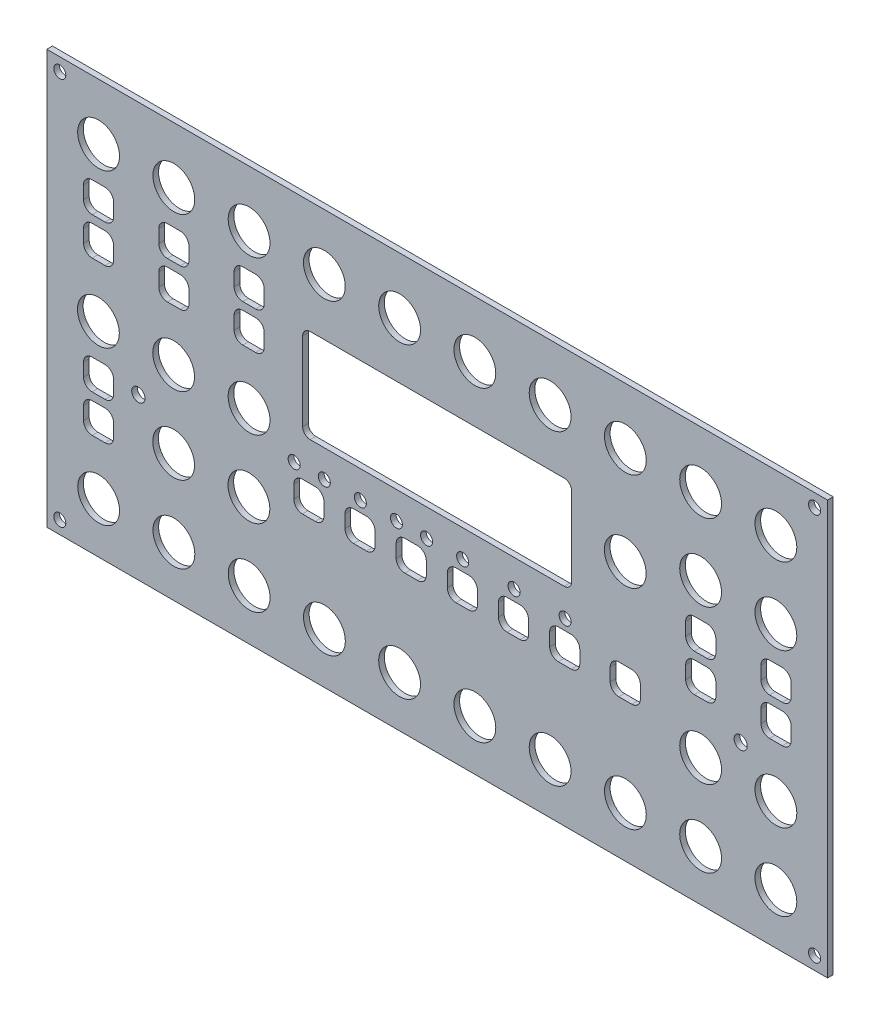
from build123d import *

# Parameters (mm, degrees)
MODEL_W         = 207.5
MODEL_H         = 110
MODEL_RX        = 5.5563
MODEL_RY        = 5.5563
MODEL_RX_2      = 1.7656
MODEL_RY_2      = 1.7656
MODEL_RX_3      = 1.6
MODEL_RY_3      = 1.6
MODEL_RX_4      = 1.75
MODEL_RY_4      = 1.75
EXTRUDE_1_DEPTH = 1.5


with BuildPart() as part:
    # Model → Бобышка-Вытянуть1 (new body)
    with BuildSketch(Plane.XY):
        with Locations((-6.3877, 3.0966)):
            Rectangle(MODEL_W, MODEL_H)
        with Locations(Location((-96.3727, 43.142), (0, 0, 90))):
            Ellipse(MODEL_RX, MODEL_RY, mode=Mode.SUBTRACT)
        with Locations(Location((-76.3738, 43.142), (0, 0, 90))):
            Ellipse(MODEL_RX, MODEL_RY, mode=Mode.SUBTRACT)
        with Locations(Location((-96.4221, 2.3418), (0, 0, 90))):
            Ellipse(MODEL_RX, MODEL_RY, mode=Mode.SUBTRACT)
        with Locations(Location((-76.4232, 2.3418), (0, 0, 90))):
            Ellipse(MODEL_RX, MODEL_RY, mode=Mode.SUBTRACT)
        with Locations(Location((-96.3568, -38.4583), (0, 0, 90))):
            Ellipse(MODEL_RX, MODEL_RY, mode=Mode.SUBTRACT)
        with Locations(Location((-76.3579, -38.4583), (0, 0, 90))):
            Ellipse(MODEL_RX, MODEL_RY, mode=Mode.SUBTRACT)
        with Locations(Location((-56.3572, -38.4583), (0, 0, 90))):
            Ellipse(MODEL_RX, MODEL_RY, mode=Mode.SUBTRACT)
        with Locations(Location((-36.3583, -38.4583), (0, 0, 90))):
            Ellipse(MODEL_RX, MODEL_RY, mode=Mode.SUBTRACT)
        with Locations(Location((-16.3735, -38.4583), (0, 0, 90))):
            Ellipse(MODEL_RX, MODEL_RY, mode=Mode.SUBTRACT)
        with Locations((3.6254, -38.4583)):
            Ellipse(MODEL_RX, MODEL_RY, mode=Mode.SUBTRACT)
        with Locations(Location((23.6261, -38.4583), (0, 0, 90))):
            Ellipse(MODEL_RX, MODEL_RY, mode=Mode.SUBTRACT)
        with Locations(Location((43.625, -38.4583), (0, 0, 90))):
            Ellipse(MODEL_RX, MODEL_RY, mode=Mode.SUBTRACT)
        with Locations(Location((63.6257, -38.4583), (0, 0, 90))):
            Ellipse(MODEL_RX, MODEL_RY, mode=Mode.SUBTRACT)
        with Locations(Location((63.6257, -18.0591), (0, 0, 90))):
            Ellipse(MODEL_RX, MODEL_RY, mode=Mode.SUBTRACT)
        with Locations(Location((83.6246, -18.0591), (0, 0, 90))):
            Ellipse(MODEL_RX, MODEL_RY, mode=Mode.SUBTRACT)
        with Locations(Location((63.6257, 22.7411), (0, 0, 90))):
            Ellipse(MODEL_RX, MODEL_RY, mode=Mode.SUBTRACT)
        with Locations(Location((83.6246, 22.7411), (0, 0, 90))):
            Ellipse(MODEL_RX, MODEL_RY, mode=Mode.SUBTRACT)
        with Locations(Location((63.6257, 43.142), (0, 0, 90))):
            Ellipse(MODEL_RX, MODEL_RY, mode=Mode.SUBTRACT)
        with Locations(Location((83.6246, 43.142), (0, 0, 90))):
            Ellipse(MODEL_RX, MODEL_RY, mode=Mode.SUBTRACT)
        with Locations(Location((23.6261, 43.142), (0, 0, 90))):
            Ellipse(MODEL_RX, MODEL_RY, mode=Mode.SUBTRACT)
        with Locations(Location((43.625, 43.142), (0, 0, 90))):
            Ellipse(MODEL_RX, MODEL_RY, mode=Mode.SUBTRACT)
        with Locations(Location((-16.3735, 43.142), (0, 0, 90))):
            Ellipse(MODEL_RX, MODEL_RY, mode=Mode.SUBTRACT)
        with Locations((3.6254, 43.142)):
            Ellipse(MODEL_RX, MODEL_RY, mode=Mode.SUBTRACT)
        with Locations(Location((-76.4215, -18.0591), (0, 0, 90))):
            Ellipse(MODEL_RX, MODEL_RY, mode=Mode.SUBTRACT)
        with Locations(Location((-56.4226, -18.0591), (0, 0, 90))):
            Ellipse(MODEL_RX, MODEL_RY, mode=Mode.SUBTRACT)
        with Locations(Location((-56.3731, 43.142), (0, 0, 90))):
            Ellipse(MODEL_RX, MODEL_RY, mode=Mode.SUBTRACT)
        with Locations(Location((-36.3742, 43.142), (0, 0, 90))):
            Ellipse(MODEL_RX, MODEL_RY, mode=Mode.SUBTRACT)
        with Locations(Location((-56.3749, 2.3418), (0, 0, 90))):
            Ellipse(MODEL_RX, MODEL_RY, mode=Mode.SUBTRACT)
        with Locations(Location((43.5968, 17.0508), (0, 0, 90))):
            Ellipse(MODEL_RX, MODEL_RY, mode=Mode.SUBTRACT)
        with Locations(Location((-85.8018, -9.238), (0, 0, 180))):
            Ellipse(MODEL_RX_2, MODEL_RY_2, mode=Mode.SUBTRACT)
        with Locations(Location((-106.6826, 54.6408), (0, 0, 270))):
            Ellipse(MODEL_RX_3, MODEL_RY_3, mode=Mode.SUBTRACT)
        with Locations(Location((-106.6826, -48.4638), (0, 0, 270))):
            Ellipse(MODEL_RX_3, MODEL_RY_3, mode=Mode.SUBTRACT)
        with Locations(Location((93.8945, 54.6408), (0, 0, 180))):
            Ellipse(MODEL_RX_3, MODEL_RY_3, mode=Mode.SUBTRACT)
        with Locations(Location((74.262, -9.238), (0, 0, 180))):
            Ellipse(MODEL_RX_4, MODEL_RY_4, mode=Mode.SUBTRACT)
        with Locations(Location((-44.3965, -4.0453), (0, 0, 90))):
            Ellipse(MODEL_RX_3, MODEL_RY_3, mode=Mode.SUBTRACT)
        with Locations(Location((-36.3796, -4.0453), (0, 0, 90))):
            Ellipse(MODEL_RX_3, MODEL_RY_3, mode=Mode.SUBTRACT)
        with Locations(Location((-26.8017, -4.0453), (0, 0, 180))):
            Ellipse(MODEL_RX_3, MODEL_RY_3, mode=Mode.SUBTRACT)
        with Locations(Location((-17.2236, -4.0453), (0, 0, 180))):
            Ellipse(MODEL_RX_3, MODEL_RY_3, mode=Mode.SUBTRACT)
        with Locations(Location((-9.2066, -4.0453), (0, 0, 180))):
            Ellipse(MODEL_RX_3, MODEL_RY_3, mode=Mode.SUBTRACT)
        with Locations(Location((0.3845, -4.0453), (0, 0, 180))):
            Ellipse(MODEL_RX_3, MODEL_RY_3, mode=Mode.SUBTRACT)
        with Locations(Location((14.037, -4.0453), (0, 0, 180))):
            Ellipse(MODEL_RX_3, MODEL_RY_3, mode=Mode.SUBTRACT)
        with Locations(Location((27.6102, -4.0453), (0, 0, 180))):
            Ellipse(MODEL_RX_3, MODEL_RY_3, mode=Mode.SUBTRACT)
        with Locations(Location((83.6246, -38.4583), (0, 0, 90))):
            Ellipse(MODEL_RX, MODEL_RY, mode=Mode.SUBTRACT)
        with Locations(Location((93.8945, -48.4638), (0, 0, 180))):
            Ellipse(MODEL_RX_3, MODEL_RY_3, mode=Mode.SUBTRACT)
        with BuildLine():
            Line((-40.1364, 28.1427), (27.3636, 28.1427))
            add(Edge.make_bspline(
                [(27.3636, 28.1427), (28.4636, 28.1427), (29.3636, 27.2427), (29.3636, 26.1427)],
                knots=[0.111111111, 0.111111111, 0.111111111, 0.111111111, 0.222222222, 0.222222222, 0.222222222, 0.222222222], degree=3))
            Line((29.3636, 26.1427), (29.3636, 5.2508))
            add(Edge.make_bspline(
                [(29.3636, 5.2508), (29.3636, 4.1508), (28.4636, 3.2508), (27.3636, 3.2508)],
                knots=[0.333333333, 0.333333333, 0.333333333, 0.333333333, 0.444444444, 0.444444444, 0.444444444, 0.444444444], degree=3))
            Line((27.3636, 3.2508), (-40.1364, 3.2508))
            add(Edge.make_bspline(
                [(-40.1364, 3.2508), (-41.2364, 3.2508), (-42.1364, 4.1508), (-42.1364, 5.2508)],
                knots=[0.555555556, 0.555555556, 0.555555556, 0.555555556, 0.666666667, 0.666666667, 0.666666667, 0.666666667], degree=3))
            Line((-42.1364, 5.2508), (-42.1364, 26.1427))
            add(Edge.make_bspline(
                [(-42.1364, 26.1427), (-42.1364, 27.2427), (-41.2364, 28.1427), (-40.1364, 28.1427)],
                knots=[0.777777778, 0.777777778, 0.777777778, 0.777777778, 1, 1, 1, 1], degree=3))
        make_face(mode=Mode.SUBTRACT)
        with BuildLine():
            Line((-94.6584, 34.0806), (-98.087, 34.0806))
            add(Edge.make_bspline(
                [(-98.087, 34.0806), (-99.3442, 34.0806), (-100.3727, 33.0521), (-100.3727, 31.7949)],
                knots=[0.111111111, 0.111111111, 0.111111111, 0.111111111, 0.222222222, 0.222222222, 0.222222222, 0.222222222], degree=3))
            Line((-100.3727, 31.7949), (-100.3727, 28.3663))
            add(Edge.make_bspline(
                [(-100.3727, 28.3663), (-100.3727, 27.1091), (-99.3442, 26.0806), (-98.087, 26.0806)],
                knots=[0.333333333, 0.333333333, 0.333333333, 0.333333333, 0.444444444, 0.444444444, 0.444444444, 0.444444444], degree=3))
            Line((-98.087, 26.0806), (-94.6584, 26.0806))
            add(Edge.make_bspline(
                [(-94.6584, 26.0806), (-93.4012, 26.0806), (-92.3727, 27.1091), (-92.3727, 28.3663)],
                knots=[0.555555556, 0.555555556, 0.555555556, 0.555555556, 0.666666667, 0.666666667, 0.666666667, 0.666666667], degree=3))
            Line((-92.3727, 28.3663), (-92.3727, 31.7949))
            add(Edge.make_bspline(
                [(-92.3727, 31.7949), (-92.3727, 33.0521), (-93.4012, 34.0806), (-94.6584, 34.0806)],
                knots=[0.777777778, 0.777777778, 0.777777778, 0.777777778, 1, 1, 1, 1], degree=3))
        make_face(mode=Mode.SUBTRACT)
        with BuildLine():
            Line((-94.6584, 24.0706), (-98.087, 24.0706))
            add(Edge.make_bspline(
                [(-98.087, 24.0706), (-99.3442, 24.0706), (-100.3727, 23.0421), (-100.3727, 21.7849)],
                knots=[0.111111111, 0.111111111, 0.111111111, 0.111111111, 0.222222222, 0.222222222, 0.222222222, 0.222222222], degree=3))
            Line((-100.3727, 21.7849), (-100.3727, 18.3563))
            add(Edge.make_bspline(
                [(-100.3727, 18.3563), (-100.3727, 17.0991), (-99.3442, 16.0706), (-98.087, 16.0706)],
                knots=[0.333333333, 0.333333333, 0.333333333, 0.333333333, 0.444444444, 0.444444444, 0.444444444, 0.444444444], degree=3))
            Line((-98.087, 16.0706), (-94.6584, 16.0706))
            add(Edge.make_bspline(
                [(-94.6584, 16.0706), (-93.4012, 16.0706), (-92.3727, 17.0991), (-92.3727, 18.3563)],
                knots=[0.555555556, 0.555555556, 0.555555556, 0.555555556, 0.666666667, 0.666666667, 0.666666667, 0.666666667], degree=3))
            Line((-92.3727, 18.3563), (-92.3727, 21.7849))
            add(Edge.make_bspline(
                [(-92.3727, 21.7849), (-92.3727, 23.0421), (-93.4012, 24.0706), (-94.6584, 24.0706)],
                knots=[0.777777778, 0.777777778, 0.777777778, 0.777777778, 1, 1, 1, 1], degree=3))
        make_face(mode=Mode.SUBTRACT)
        with BuildLine():
            Line((-74.6595, 33.9889), (-78.0881, 33.9889))
            add(Edge.make_bspline(
                [(-78.0881, 33.9889), (-79.3453, 33.9889), (-80.3738, 32.9604), (-80.3738, 31.7032)],
                knots=[0.111111111, 0.111111111, 0.111111111, 0.111111111, 0.222222222, 0.222222222, 0.222222222, 0.222222222], degree=3))
            Line((-80.3738, 31.7032), (-80.3738, 28.2746))
            add(Edge.make_bspline(
                [(-80.3738, 28.2746), (-80.3738, 27.0174), (-79.3453, 25.9889), (-78.0881, 25.9889)],
                knots=[0.333333333, 0.333333333, 0.333333333, 0.333333333, 0.444444444, 0.444444444, 0.444444444, 0.444444444], degree=3))
            Line((-78.0881, 25.9889), (-74.6595, 25.9889))
            add(Edge.make_bspline(
                [(-74.6595, 25.9889), (-73.4023, 25.9889), (-72.3738, 27.0174), (-72.3738, 28.2746)],
                knots=[0.555555556, 0.555555556, 0.555555556, 0.555555556, 0.666666667, 0.666666667, 0.666666667, 0.666666667], degree=3))
            Line((-72.3738, 28.2746), (-72.3738, 31.7032))
            add(Edge.make_bspline(
                [(-72.3738, 31.7032), (-72.3738, 32.9604), (-73.4023, 33.9889), (-74.6595, 33.9889)],
                knots=[0.777777778, 0.777777778, 0.777777778, 0.777777778, 1, 1, 1, 1], degree=3))
        make_face(mode=Mode.SUBTRACT)
        with BuildLine():
            Line((-74.6595, 23.9789), (-78.0881, 23.9789))
            add(Edge.make_bspline(
                [(-78.0881, 23.9789), (-79.3453, 23.9789), (-80.3738, 22.9504), (-80.3738, 21.6932)],
                knots=[0.111111111, 0.111111111, 0.111111111, 0.111111111, 0.222222222, 0.222222222, 0.222222222, 0.222222222], degree=3))
            Line((-80.3738, 21.6932), (-80.3738, 18.2646))
            add(Edge.make_bspline(
                [(-80.3738, 18.2646), (-80.3738, 17.0074), (-79.3453, 15.9789), (-78.0881, 15.9789)],
                knots=[0.333333333, 0.333333333, 0.333333333, 0.333333333, 0.444444444, 0.444444444, 0.444444444, 0.444444444], degree=3))
            Line((-78.0881, 15.9789), (-74.6595, 15.9789))
            add(Edge.make_bspline(
                [(-74.6595, 15.9789), (-73.4023, 15.9789), (-72.3738, 17.0074), (-72.3738, 18.2646)],
                knots=[0.555555556, 0.555555556, 0.555555556, 0.555555556, 0.666666667, 0.666666667, 0.666666667, 0.666666667], degree=3))
            Line((-72.3738, 18.2646), (-72.3738, 21.6932))
            add(Edge.make_bspline(
                [(-72.3738, 21.6932), (-72.3738, 22.9504), (-73.4023, 23.9789), (-74.6595, 23.9789)],
                knots=[0.777777778, 0.777777778, 0.777777778, 0.777777778, 1, 1, 1, 1], degree=3))
        make_face(mode=Mode.SUBTRACT)
        with BuildLine():
            Line((-54.6394, 34.0718), (-58.068, 34.0718))
            add(Edge.make_bspline(
                [(-58.068, 34.0718), (-59.3252, 34.0718), (-60.3537, 33.0433), (-60.3537, 31.7861)],
                knots=[0.111111111, 0.111111111, 0.111111111, 0.111111111, 0.222222222, 0.222222222, 0.222222222, 0.222222222], degree=3))
            Line((-60.3537, 31.7861), (-60.3537, 28.3575))
            add(Edge.make_bspline(
                [(-60.3537, 28.3575), (-60.3537, 27.1003), (-59.3252, 26.0718), (-58.068, 26.0718)],
                knots=[0.333333333, 0.333333333, 0.333333333, 0.333333333, 0.444444444, 0.444444444, 0.444444444, 0.444444444], degree=3))
            Line((-58.068, 26.0718), (-54.6394, 26.0718))
            add(Edge.make_bspline(
                [(-54.6394, 26.0718), (-53.3822, 26.0718), (-52.3537, 27.1003), (-52.3537, 28.3575)],
                knots=[0.555555556, 0.555555556, 0.555555556, 0.555555556, 0.666666667, 0.666666667, 0.666666667, 0.666666667], degree=3))
            Line((-52.3537, 28.3575), (-52.3537, 31.7861))
            add(Edge.make_bspline(
                [(-52.3537, 31.7861), (-52.3537, 33.0433), (-53.3822, 34.0718), (-54.6394, 34.0718)],
                knots=[0.777777778, 0.777777778, 0.777777778, 0.777777778, 1, 1, 1, 1], degree=3))
        make_face(mode=Mode.SUBTRACT)
        with BuildLine():
            Line((-54.6394, 24.0618), (-58.068, 24.0618))
            add(Edge.make_bspline(
                [(-58.068, 24.0618), (-59.3252, 24.0618), (-60.3537, 23.0333), (-60.3537, 21.7761)],
                knots=[0.111111111, 0.111111111, 0.111111111, 0.111111111, 0.222222222, 0.222222222, 0.222222222, 0.222222222], degree=3))
            Line((-60.3537, 21.7761), (-60.3537, 18.3475))
            add(Edge.make_bspline(
                [(-60.3537, 18.3475), (-60.3537, 17.0903), (-59.3252, 16.0618), (-58.068, 16.0618)],
                knots=[0.333333333, 0.333333333, 0.333333333, 0.333333333, 0.444444444, 0.444444444, 0.444444444, 0.444444444], degree=3))
            Line((-58.068, 16.0618), (-54.6394, 16.0618))
            add(Edge.make_bspline(
                [(-54.6394, 16.0618), (-53.3822, 16.0618), (-52.3537, 17.0903), (-52.3537, 18.3475)],
                knots=[0.555555556, 0.555555556, 0.555555556, 0.555555556, 0.666666667, 0.666666667, 0.666666667, 0.666666667], degree=3))
            Line((-52.3537, 18.3475), (-52.3537, 21.7761))
            add(Edge.make_bspline(
                [(-52.3537, 21.7761), (-52.3537, 23.0333), (-53.3822, 24.0618), (-54.6394, 24.0618)],
                knots=[0.777777778, 0.777777778, 0.777777778, 0.777777778, 1, 1, 1, 1], degree=3))
        make_face(mode=Mode.SUBTRACT)
        with BuildLine():
            Line((-94.6584, -6.7301), (-98.087, -6.7301))
            add(Edge.make_bspline(
                [(-98.087, -6.7301), (-99.3442, -6.7301), (-100.3727, -7.7586), (-100.3727, -9.0158)],
                knots=[0.111111111, 0.111111111, 0.111111111, 0.111111111, 0.222222222, 0.222222222, 0.222222222, 0.222222222], degree=3))
            Line((-100.3727, -9.0158), (-100.3727, -12.4444))
            add(Edge.make_bspline(
                [(-100.3727, -12.4444), (-100.3727, -13.7016), (-99.3442, -14.7301), (-98.087, -14.7301)],
                knots=[0.333333333, 0.333333333, 0.333333333, 0.333333333, 0.444444444, 0.444444444, 0.444444444, 0.444444444], degree=3))
            Line((-98.087, -14.7301), (-94.6584, -14.7301))
            add(Edge.make_bspline(
                [(-94.6584, -14.7301), (-93.4012, -14.7301), (-92.3727, -13.7016), (-92.3727, -12.4444)],
                knots=[0.555555556, 0.555555556, 0.555555556, 0.555555556, 0.666666667, 0.666666667, 0.666666667, 0.666666667], degree=3))
            Line((-92.3727, -12.4444), (-92.3727, -9.0158))
            add(Edge.make_bspline(
                [(-92.3727, -9.0158), (-92.3727, -7.7586), (-93.4012, -6.7301), (-94.6584, -6.7301)],
                knots=[0.777777778, 0.777777778, 0.777777778, 0.777777778, 1, 1, 1, 1], degree=3))
        make_face(mode=Mode.SUBTRACT)
        with BuildLine():
            Line((-94.6584, -16.7401), (-98.087, -16.7401))
            add(Edge.make_bspline(
                [(-98.087, -16.7401), (-99.3442, -16.7401), (-100.3727, -17.7686), (-100.3727, -19.0258)],
                knots=[0.111111111, 0.111111111, 0.111111111, 0.111111111, 0.222222222, 0.222222222, 0.222222222, 0.222222222], degree=3))
            Line((-100.3727, -19.0258), (-100.3727, -22.4544))
            add(Edge.make_bspline(
                [(-100.3727, -22.4544), (-100.3727, -23.7116), (-99.3442, -24.7401), (-98.087, -24.7401)],
                knots=[0.333333333, 0.333333333, 0.333333333, 0.333333333, 0.444444444, 0.444444444, 0.444444444, 0.444444444], degree=3))
            Line((-98.087, -24.7401), (-94.6584, -24.7401))
            add(Edge.make_bspline(
                [(-94.6584, -24.7401), (-93.4012, -24.7401), (-92.3727, -23.7116), (-92.3727, -22.4544)],
                knots=[0.555555556, 0.555555556, 0.555555556, 0.555555556, 0.666666667, 0.666666667, 0.666666667, 0.666666667], degree=3))
            Line((-92.3727, -22.4544), (-92.3727, -19.0258))
            add(Edge.make_bspline(
                [(-92.3727, -19.0258), (-92.3727, -17.7686), (-93.4012, -16.7401), (-94.6584, -16.7401)],
                knots=[0.777777778, 0.777777778, 0.777777778, 0.777777778, 1, 1, 1, 1], degree=3))
        make_face(mode=Mode.SUBTRACT)
        with BuildLine():
            Line((65.3718, 13.632), (61.9432, 13.632))
            add(Edge.make_bspline(
                [(61.9432, 13.632), (60.686, 13.632), (59.6575, 12.6035), (59.6575, 11.3463)],
                knots=[0.111111111, 0.111111111, 0.111111111, 0.111111111, 0.222222222, 0.222222222, 0.222222222, 0.222222222], degree=3))
            Line((59.6575, 11.3463), (59.6575, 7.9177))
            add(Edge.make_bspline(
                [(59.6575, 7.9177), (59.6575, 6.6605), (60.686, 5.632), (61.9432, 5.632)],
                knots=[0.333333333, 0.333333333, 0.333333333, 0.333333333, 0.444444444, 0.444444444, 0.444444444, 0.444444444], degree=3))
            Line((61.9432, 5.632), (65.3718, 5.632))
            add(Edge.make_bspline(
                [(65.3718, 5.632), (66.629, 5.632), (67.6575, 6.6605), (67.6575, 7.9177)],
                knots=[0.555555556, 0.555555556, 0.555555556, 0.555555556, 0.666666667, 0.666666667, 0.666666667, 0.666666667], degree=3))
            Line((67.6575, 7.9177), (67.6575, 11.3463))
            add(Edge.make_bspline(
                [(67.6575, 11.3463), (67.6575, 12.6035), (66.629, 13.632), (65.3718, 13.632)],
                knots=[0.777777778, 0.777777778, 0.777777778, 0.777777778, 1, 1, 1, 1], degree=3))
        make_face(mode=Mode.SUBTRACT)
        with BuildLine():
            Line((65.3718, 3.622), (61.9432, 3.622))
            add(Edge.make_bspline(
                [(61.9432, 3.622), (60.686, 3.622), (59.6575, 2.5935), (59.6575, 1.3363)],
                knots=[0.111111111, 0.111111111, 0.111111111, 0.111111111, 0.222222222, 0.222222222, 0.222222222, 0.222222222], degree=3))
            Line((59.6575, 1.3363), (59.6575, -2.0923))
            add(Edge.make_bspline(
                [(59.6575, -2.0923), (59.6575, -3.3495), (60.686, -4.378), (61.9432, -4.378)],
                knots=[0.333333333, 0.333333333, 0.333333333, 0.333333333, 0.444444444, 0.444444444, 0.444444444, 0.444444444], degree=3))
            Line((61.9432, -4.378), (65.3718, -4.378))
            add(Edge.make_bspline(
                [(65.3718, -4.378), (66.629, -4.378), (67.6575, -3.3495), (67.6575, -2.0923)],
                knots=[0.555555556, 0.555555556, 0.555555556, 0.555555556, 0.666666667, 0.666666667, 0.666666667, 0.666666667], degree=3))
            Line((67.6575, -2.0923), (67.6575, 1.3363))
            add(Edge.make_bspline(
                [(67.6575, 1.3363), (67.6575, 2.5935), (66.629, 3.622), (65.3718, 3.622)],
                knots=[0.777777778, 0.777777778, 0.777777778, 0.777777778, 1, 1, 1, 1], degree=3))
        make_face(mode=Mode.SUBTRACT)
        with BuildLine():
            Line((85.3707, 13.5403), (81.9421, 13.5403))
            add(Edge.make_bspline(
                [(81.9421, 13.5403), (80.6849, 13.5403), (79.6564, 12.5118), (79.6564, 11.2546)],
                knots=[0.111111111, 0.111111111, 0.111111111, 0.111111111, 0.222222222, 0.222222222, 0.222222222, 0.222222222], degree=3))
            Line((79.6564, 11.2546), (79.6564, 7.826))
            add(Edge.make_bspline(
                [(79.6564, 7.826), (79.6564, 6.5688), (80.6849, 5.5403), (81.9421, 5.5403)],
                knots=[0.333333333, 0.333333333, 0.333333333, 0.333333333, 0.444444444, 0.444444444, 0.444444444, 0.444444444], degree=3))
            Line((81.9421, 5.5403), (85.3707, 5.5403))
            add(Edge.make_bspline(
                [(85.3707, 5.5403), (86.6279, 5.5403), (87.6564, 6.5688), (87.6564, 7.826)],
                knots=[0.555555556, 0.555555556, 0.555555556, 0.555555556, 0.666666667, 0.666666667, 0.666666667, 0.666666667], degree=3))
            Line((87.6564, 7.826), (87.6564, 11.2546))
            add(Edge.make_bspline(
                [(87.6564, 11.2546), (87.6564, 12.5118), (86.6279, 13.5403), (85.3707, 13.5403)],
                knots=[0.777777778, 0.777777778, 0.777777778, 0.777777778, 1, 1, 1, 1], degree=3))
        make_face(mode=Mode.SUBTRACT)
        with BuildLine():
            Line((85.3707, 3.5303), (81.9421, 3.5303))
            add(Edge.make_bspline(
                [(81.9421, 3.5303), (80.6849, 3.5303), (79.6564, 2.5018), (79.6564, 1.2446)],
                knots=[0.111111111, 0.111111111, 0.111111111, 0.111111111, 0.222222222, 0.222222222, 0.222222222, 0.222222222], degree=3))
            Line((79.6564, 1.2446), (79.6564, -2.184))
            add(Edge.make_bspline(
                [(79.6564, -2.184), (79.6564, -3.4412), (80.6849, -4.4697), (81.9421, -4.4697)],
                knots=[0.333333333, 0.333333333, 0.333333333, 0.333333333, 0.444444444, 0.444444444, 0.444444444, 0.444444444], degree=3))
            Line((81.9421, -4.4697), (85.3707, -4.4697))
            add(Edge.make_bspline(
                [(85.3707, -4.4697), (86.6279, -4.4697), (87.6564, -3.4412), (87.6564, -2.184)],
                knots=[0.555555556, 0.555555556, 0.555555556, 0.555555556, 0.666666667, 0.666666667, 0.666666667, 0.666666667], degree=3))
            Line((87.6564, -2.184), (87.6564, 1.2446))
            add(Edge.make_bspline(
                [(87.6564, 1.2446), (87.6564, 2.5018), (86.6279, 3.5303), (85.3707, 3.5303)],
                knots=[0.777777778, 0.777777778, 0.777777778, 0.777777778, 1, 1, 1, 1], degree=3))
        make_face(mode=Mode.SUBTRACT)
        with BuildLine():
            Line((-38.7751, -6.8889), (-42.2037, -6.8889))
            add(Edge.make_bspline(
                [(-42.2037, -6.8889), (-43.4609, -6.8889), (-44.4894, -7.9174), (-44.4894, -9.1746)],
                knots=[0.111111111, 0.111111111, 0.111111111, 0.111111111, 0.222222222, 0.222222222, 0.222222222, 0.222222222], degree=3))
            Line((-44.4894, -9.1746), (-44.4894, -12.6032))
            add(Edge.make_bspline(
                [(-44.4894, -12.6032), (-44.4894, -13.8604), (-43.4609, -14.8889), (-42.2037, -14.8889)],
                knots=[0.333333333, 0.333333333, 0.333333333, 0.333333333, 0.444444444, 0.444444444, 0.444444444, 0.444444444], degree=3))
            Line((-42.2037, -14.8889), (-38.7751, -14.8889))
            add(Edge.make_bspline(
                [(-38.7751, -14.8889), (-37.5179, -14.8889), (-36.4894, -13.8604), (-36.4894, -12.6032)],
                knots=[0.555555556, 0.555555556, 0.555555556, 0.555555556, 0.666666667, 0.666666667, 0.666666667, 0.666666667], degree=3))
            Line((-36.4894, -12.6032), (-36.4894, -9.1746))
            add(Edge.make_bspline(
                [(-36.4894, -9.1746), (-36.4894, -7.9174), (-37.5179, -6.8889), (-38.7751, -6.8889)],
                knots=[0.777777778, 0.777777778, 0.777777778, 0.777777778, 1, 1, 1, 1], degree=3))
        make_face(mode=Mode.SUBTRACT)
        with BuildLine():
            Line((-25.179, -6.8889), (-28.6076, -6.8889))
            add(Edge.make_bspline(
                [(-28.6076, -6.8889), (-29.8648, -6.8889), (-30.8933, -7.9174), (-30.8933, -9.1746)],
                knots=[0.111111111, 0.111111111, 0.111111111, 0.111111111, 0.222222222, 0.222222222, 0.222222222, 0.222222222], degree=3))
            Line((-30.8933, -9.1746), (-30.8933, -12.6032))
            add(Edge.make_bspline(
                [(-30.8933, -12.6032), (-30.8933, -13.8604), (-29.8648, -14.8889), (-28.6076, -14.8889)],
                knots=[0.333333333, 0.333333333, 0.333333333, 0.333333333, 0.444444444, 0.444444444, 0.444444444, 0.444444444], degree=3))
            Line((-28.6076, -14.8889), (-25.179, -14.8889))
            add(Edge.make_bspline(
                [(-25.179, -14.8889), (-23.9218, -14.8889), (-22.8933, -13.8604), (-22.8933, -12.6032)],
                knots=[0.555555556, 0.555555556, 0.555555556, 0.555555556, 0.666666667, 0.666666667, 0.666666667, 0.666666667], degree=3))
            Line((-22.8933, -12.6032), (-22.8933, -9.1746))
            add(Edge.make_bspline(
                [(-22.8933, -9.1746), (-22.8933, -7.9174), (-23.9218, -6.8889), (-25.179, -6.8889)],
                knots=[0.777777778, 0.777777778, 0.777777778, 0.777777778, 1, 1, 1, 1], degree=3))
        make_face(mode=Mode.SUBTRACT)
        with BuildLine():
            Line((-11.5688, -6.8889), (-14.9974, -6.8889))
            add(Edge.make_bspline(
                [(-14.9974, -6.8889), (-16.2546, -6.8889), (-17.2831, -7.9174), (-17.2831, -9.1746)],
                knots=[0.111111111, 0.111111111, 0.111111111, 0.111111111, 0.222222222, 0.222222222, 0.222222222, 0.222222222], degree=3))
            Line((-17.2831, -9.1746), (-17.2831, -12.6032))
            add(Edge.make_bspline(
                [(-17.2831, -12.6032), (-17.2831, -13.8604), (-16.2546, -14.8889), (-14.9974, -14.8889)],
                knots=[0.333333333, 0.333333333, 0.333333333, 0.333333333, 0.444444444, 0.444444444, 0.444444444, 0.444444444], degree=3))
            Line((-14.9974, -14.8889), (-11.5688, -14.8889))
            add(Edge.make_bspline(
                [(-11.5688, -14.8889), (-10.3116, -14.8889), (-9.2831, -13.8604), (-9.2831, -12.6032)],
                knots=[0.555555556, 0.555555556, 0.555555556, 0.555555556, 0.666666667, 0.666666667, 0.666666667, 0.666666667], degree=3))
            Line((-9.2831, -12.6032), (-9.2831, -9.1746))
            add(Edge.make_bspline(
                [(-9.2831, -9.1746), (-9.2831, -7.9174), (-10.3116, -6.8889), (-11.5688, -6.8889)],
                knots=[0.777777778, 0.777777778, 0.777777778, 0.777777778, 1, 1, 1, 1], degree=3))
        make_face(mode=Mode.SUBTRACT)
        with BuildLine():
            Line((2.0273, -6.8889), (-1.4013, -6.8889))
            add(Edge.make_bspline(
                [(-1.4013, -6.8889), (-2.6585, -6.8889), (-3.687, -7.9174), (-3.687, -9.1746)],
                knots=[0.111111111, 0.111111111, 0.111111111, 0.111111111, 0.222222222, 0.222222222, 0.222222222, 0.222222222], degree=3))
            Line((-3.687, -9.1746), (-3.687, -12.6032))
            add(Edge.make_bspline(
                [(-3.687, -12.6032), (-3.687, -13.8604), (-2.6585, -14.8889), (-1.4013, -14.8889)],
                knots=[0.333333333, 0.333333333, 0.333333333, 0.333333333, 0.444444444, 0.444444444, 0.444444444, 0.444444444], degree=3))
            Line((-1.4013, -14.8889), (2.0273, -14.8889))
            add(Edge.make_bspline(
                [(2.0273, -14.8889), (3.2845, -14.8889), (4.313, -13.8604), (4.313, -12.6032)],
                knots=[0.555555556, 0.555555556, 0.555555556, 0.555555556, 0.666666667, 0.666666667, 0.666666667, 0.666666667], degree=3))
            Line((4.313, -12.6032), (4.313, -9.1746))
            add(Edge.make_bspline(
                [(4.313, -9.1746), (4.313, -7.9174), (3.2845, -6.8889), (2.0273, -6.8889)],
                knots=[0.777777778, 0.777777778, 0.777777778, 0.777777778, 1, 1, 1, 1], degree=3))
        make_face(mode=Mode.SUBTRACT)
        with BuildLine():
            Line((15.6214, -6.8889), (12.1928, -6.8889))
            add(Edge.make_bspline(
                [(12.1928, -6.8889), (10.9356, -6.8889), (9.9071, -7.9174), (9.9071, -9.1746)],
                knots=[0.111111111, 0.111111111, 0.111111111, 0.111111111, 0.222222222, 0.222222222, 0.222222222, 0.222222222], degree=3))
            Line((9.9071, -9.1746), (9.9071, -12.6032))
            add(Edge.make_bspline(
                [(9.9071, -12.6032), (9.9071, -13.8604), (10.9356, -14.8889), (12.1928, -14.8889)],
                knots=[0.333333333, 0.333333333, 0.333333333, 0.333333333, 0.444444444, 0.444444444, 0.444444444, 0.444444444], degree=3))
            Line((12.1928, -14.8889), (15.6214, -14.8889))
            add(Edge.make_bspline(
                [(15.6214, -14.8889), (16.8786, -14.8889), (17.9071, -13.8604), (17.9071, -12.6032)],
                knots=[0.555555556, 0.555555556, 0.555555556, 0.555555556, 0.666666667, 0.666666667, 0.666666667, 0.666666667], degree=3))
            Line((17.9071, -12.6032), (17.9071, -9.1746))
            add(Edge.make_bspline(
                [(17.9071, -9.1746), (17.9071, -7.9174), (16.8786, -6.8889), (15.6214, -6.8889)],
                knots=[0.777777778, 0.777777778, 0.777777778, 0.777777778, 1, 1, 1, 1], degree=3))
        make_face(mode=Mode.SUBTRACT)
        with BuildLine():
            Line((29.2175, -6.8889), (25.7889, -6.8889))
            add(Edge.make_bspline(
                [(25.7889, -6.8889), (24.5317, -6.8889), (23.5032, -7.9174), (23.5032, -9.1746)],
                knots=[0.111111111, 0.111111111, 0.111111111, 0.111111111, 0.222222222, 0.222222222, 0.222222222, 0.222222222], degree=3))
            Line((23.5032, -9.1746), (23.5032, -12.6032))
            add(Edge.make_bspline(
                [(23.5032, -12.6032), (23.5032, -13.8604), (24.5317, -14.8889), (25.7889, -14.8889)],
                knots=[0.333333333, 0.333333333, 0.333333333, 0.333333333, 0.444444444, 0.444444444, 0.444444444, 0.444444444], degree=3))
            Line((25.7889, -14.8889), (29.2175, -14.8889))
            add(Edge.make_bspline(
                [(29.2175, -14.8889), (30.4747, -14.8889), (31.5032, -13.8604), (31.5032, -12.6032)],
                knots=[0.555555556, 0.555555556, 0.555555556, 0.555555556, 0.666666667, 0.666666667, 0.666666667, 0.666666667], degree=3))
            Line((31.5032, -12.6032), (31.5032, -9.1746))
            add(Edge.make_bspline(
                [(31.5032, -9.1746), (31.5032, -7.9174), (30.4747, -6.8889), (29.2175, -6.8889)],
                knots=[0.777777778, 0.777777778, 0.777777778, 0.777777778, 1, 1, 1, 1], degree=3))
        make_face(mode=Mode.SUBTRACT)
        with BuildLine():
            Line((45.311, -6.9101), (41.8824, -6.9101))
            add(Edge.make_bspline(
                [(41.8824, -6.9101), (40.6252, -6.9101), (39.5967, -7.9386), (39.5967, -9.1958)],
                knots=[0.111111111, 0.111111111, 0.111111111, 0.111111111, 0.222222222, 0.222222222, 0.222222222, 0.222222222], degree=3))
            Line((39.5967, -9.1958), (39.5967, -12.6244))
            add(Edge.make_bspline(
                [(39.5967, -12.6244), (39.5967, -13.8816), (40.6252, -14.9101), (41.8824, -14.9101)],
                knots=[0.333333333, 0.333333333, 0.333333333, 0.333333333, 0.444444444, 0.444444444, 0.444444444, 0.444444444], degree=3))
            Line((41.8824, -14.9101), (45.311, -14.9101))
            add(Edge.make_bspline(
                [(45.311, -14.9101), (46.5682, -14.9101), (47.5967, -13.8816), (47.5967, -12.6244)],
                knots=[0.555555556, 0.555555556, 0.555555556, 0.555555556, 0.666666667, 0.666666667, 0.666666667, 0.666666667], degree=3))
            Line((47.5967, -12.6244), (47.5967, -9.1958))
            add(Edge.make_bspline(
                [(47.5967, -9.1958), (47.5967, -7.9386), (46.5682, -6.9101), (45.311, -6.9101)],
                knots=[0.777777778, 0.777777778, 0.777777778, 0.777777778, 1, 1, 1, 1], degree=3))
        make_face(mode=Mode.SUBTRACT)
    extrude(amount=EXTRUDE_1_DEPTH)


solid = part.part
